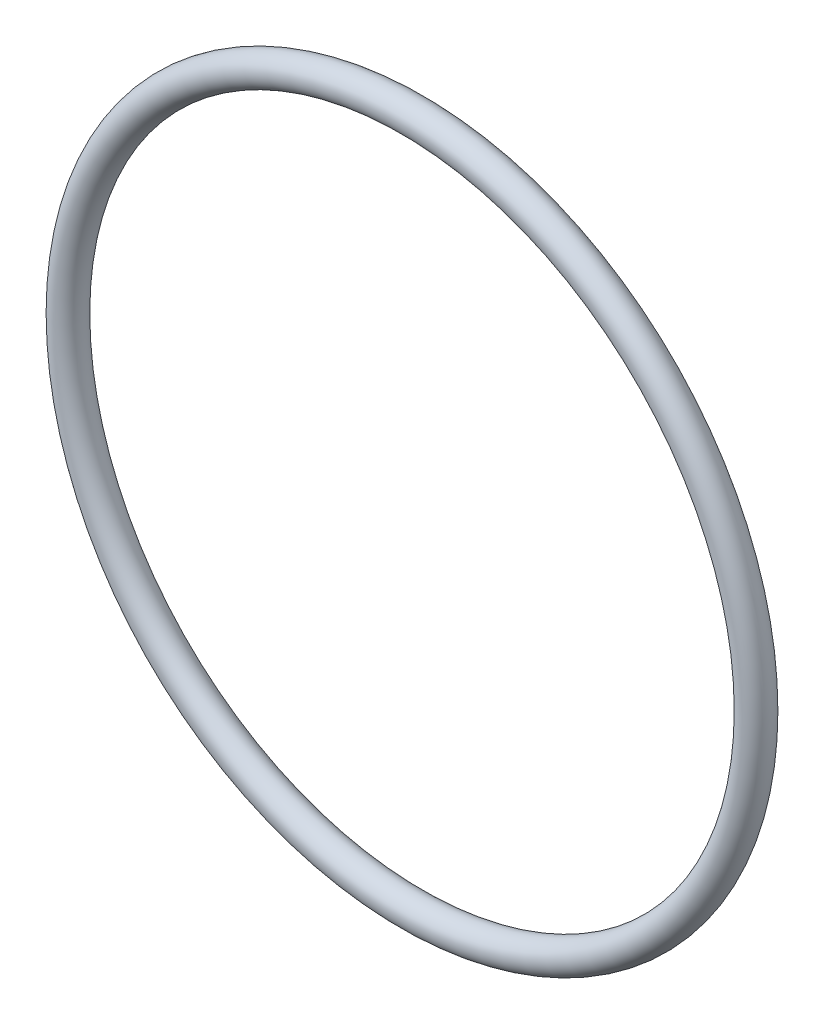
from build123d import *

# Parameters (mm, degrees)
SKETCH1_R = 0.889


with BuildPart() as part:
    # Sketch1 → Revolve1 (revolve)
    with BuildSketch(Plane(origin=(0, 0, 0), x_dir=(0, -1, 0), z_dir=(1, 0, 0)), mode=Mode.PRIVATE) as revolve1_sk:
        with Locations((19.7993, 0)):
            Circle(SKETCH1_R)
    revolve(revolve1_sk.sketch.rotate(Axis((0, 0, 0.889), (0, 0, -1)), 270), axis=Axis((0, 0, 0.889), (0, 0, -1)))


solid = part.part
